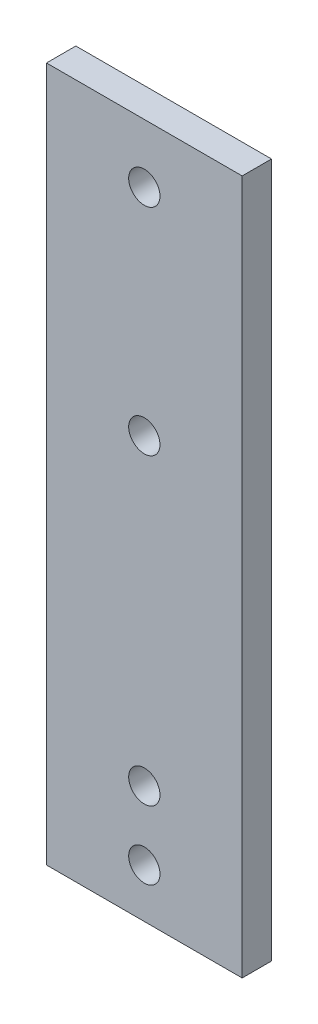
from build123d import *

# Parameters (mm, degrees)
SKETCH_1_R      = 1.6
EXTRUDE_1_DEPTH = 3


with BuildPart() as part:
    # 草图1 → 凸台-拉伸1 (new body)
    with BuildSketch(Plane.XY):
        Polygon((0, 0), (0, 35), (0, 71), (20, 71), (20, 35.473663945), (20, 0), align=None)
        with Locations((10, 65)):
            Circle(SKETCH_1_R, mode=Mode.SUBTRACT)
        with Locations((10, 43)):
            Circle(SKETCH_1_R, mode=Mode.SUBTRACT)
        with Locations((10, 12)):
            Circle(SKETCH_1_R, mode=Mode.SUBTRACT)
        with Locations((10, 5)):
            Circle(SKETCH_1_R, mode=Mode.SUBTRACT)
    extrude(amount=EXTRUDE_1_DEPTH)


solid = part.part
